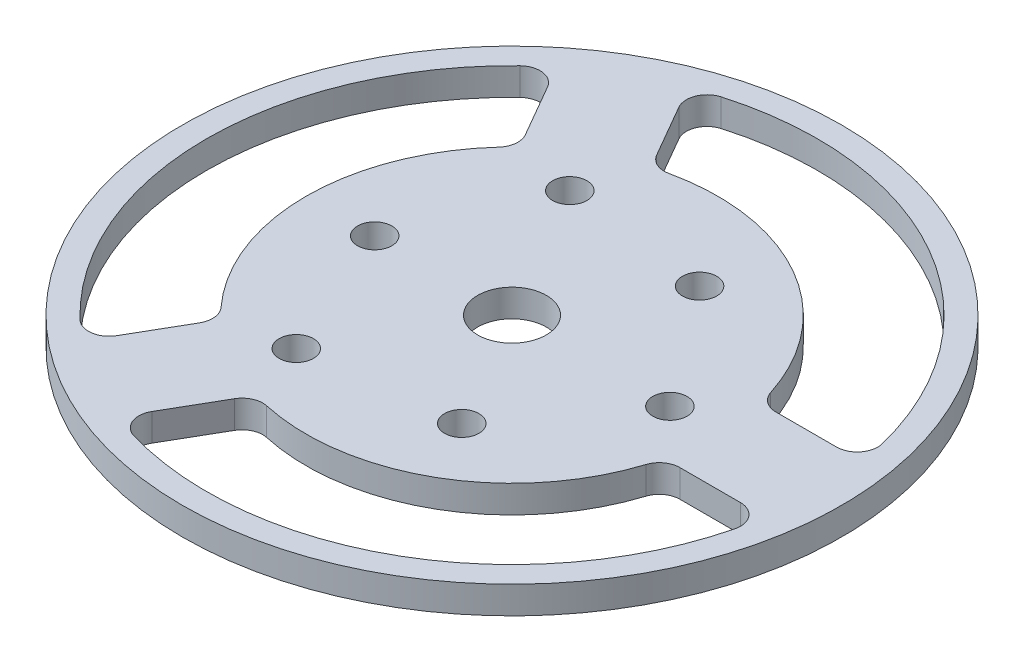
from build123d import *

# Parameters (mm, degrees)
SKETCH1_R           = 24
SKETCH1_R_2         = 2
SKETCH1_R_3         = 1.5
BOSS_EXTRUDE1_DEPTH = 2
CUT_EXTRUDE1_DEPTH  = 2
FILLET1_R           = 1.5
SKETCH3_R           = 1.75
CUT_EXTRUDE2_DEPTH  = 10
SCALE1_SCALE        = 2
SKETCH4_R           = 5
CUT_EXTRUDE3_DEPTH  = 10
SKETCH5_R           = 6.547213639
SKETCH5_R_2         = 2.5
SKETCH5_R_3         = 5.064875416
BOSS_EXTRUDE2_DEPTH = 4


with BuildPart() as part:
    # Sketch1 → Boss-Extrude1 (new body)
    with BuildSketch(Plane(origin=(0, 0, 0), x_dir=(1, 0, 0), z_dir=(0, 1, 0))):
        with Locations(Location((0, 0, 0), (0, 0, 270))):
            Circle(SKETCH1_R)
        with Locations(Location((0, 0, 0), (0, 0, 270))):
            Circle(SKETCH1_R_2, mode=Mode.SUBTRACT)
        with Locations(Location((11.5, 0, 0), (0, 0, 270))):
            Circle(SKETCH1_R_3, mode=Mode.SUBTRACT)
        with Locations(Location((-5.75, -9.959292144, 0), (0, 0, 270))):
            Circle(SKETCH1_R_3, mode=Mode.SUBTRACT)
        with Locations(Location((-5.75, 9.959292144, 0), (0, 0, 270))):
            Circle(SKETCH1_R_3, mode=Mode.SUBTRACT)
    extrude(amount=BOSS_EXTRUDE1_DEPTH)

    # Sketch2 → Cut-Extrude1 (cut)
    with BuildSketch(Plane(origin=(0, 2, 0), x_dir=(1, 0, 0), z_dir=(0, 1, 0))):
        with BuildLine():
            Line((21.972994789, 3.5), (14.585952146, 3.5))
            ThreePointArc((14.585952146, 3.5), (7.5, 12.990381057), (-4.26188716, 14.381805097))
            Line((-4.26188716, 14.381805097), (-7.955408481, 20.779171685))
            ThreePointArc((-7.955408481, 20.779171685), (11.125, 19.269065234), (21.972994789, 3.5))
        make_face()
        with BuildLine():
            Line((21.972994789, -3.5), (14.585952146, -3.5))
            ThreePointArc((14.585952146, -3.5), (7.5, -12.990381057), (-4.26188716, -14.381805097))
            Line((-4.26188716, -14.381805097), (-7.955408481, -20.779171685))
            ThreePointArc((-7.955408481, -20.779171685), (11.125, -19.269065234), (21.972994789, -3.5))
        make_face()
        with BuildLine():
            Line((-14.017586308, -17.279171685), (-10.324064986, -10.881805097))
            ThreePointArc((-10.324064986, -10.881805097), (-15, 0), (-10.324064986, 10.881805097))
            Line((-10.324064986, 10.881805097), (-14.017586308, 17.279171685))
            ThreePointArc((-14.017586308, 17.279171685), (-22.25, 0), (-14.017586308, -17.279171685))
        make_face()
    extrude(amount=-CUT_EXTRUDE1_DEPTH, mode=Mode.SUBTRACT)

    # Fillet1
    fillet1_edges = [part.edges().sort_by_distance(p)[0] for p in [
        (-7.955408481, 1, -20.779171685),
        (21.972994789, 1, -3.5),
        (14.585952146, 1, -3.5),
        (-4.26188716, 1, -14.381805097),
        (-14.017586308, 1, 17.279171685),
        (-14.017586308, 1, -17.279171685),
        (-10.324064986, 1, -10.881805097),
        (-10.324064986, 1, 10.881805097),
        (21.972994789, 1, 3.5),
        (-7.955408481, 1, 20.779171685),
        (-4.26188716, 1, 14.381805097),
        (14.585952146, 1, 3.5),
    ]]
    fillet(fillet1_edges, radius=FILLET1_R)

    # Sketch3 → Cut-Extrude2 (cut)
    with BuildSketch(Plane(origin=(0, 2, 0), x_dir=(1, 0, 0), z_dir=(0, 1, 0))):
        with Locations(Location((5, 8.660254038, 0), (0, 0, 270))):
            Circle(SKETCH3_R)
        with Locations(Location((5, -8.660254038, 0), (0, 0, 270))):
            Circle(SKETCH3_R)
        with Locations(Location((-10, 0, 0), (0, 0, 270))):
            Circle(SKETCH3_R)
    extrude(amount=-CUT_EXTRUDE2_DEPTH, mode=Mode.SUBTRACT)


with BuildPart() as part_1:
    # Scale1: scaled about (0, 1, 0)
    add(part.part.scale(SCALE1_SCALE).moved(Location((0, -1, 0))))

    # Sketch4 → Cut-Extrude3 (cut)
    with BuildSketch(Plane(origin=(0, 3, 0), x_dir=(1, 0, 0), z_dir=(0, 1, 0))):
        with Locations(Location((0, 0, 0), (0, 0, 270))):
            Circle(SKETCH4_R)
    extrude(amount=-CUT_EXTRUDE3_DEPTH, mode=Mode.SUBTRACT)

    # Sketch5 → Boss-Extrude2 (add)
    # profile 1 of 6: a face of its own
    with BuildSketch(Plane(origin=(0, 3, 0), x_dir=(1, 0, 0), z_dir=(0, 1, 0))):
        with Locations((10, 17.320508076)):
            Circle(SKETCH5_R)
        with Locations(Location((10, 17.320508076, 0), (0, 0, 270))):
            Circle(SKETCH5_R_2, mode=Mode.SUBTRACT)
    # profile 2 of 6: a face of its own
    with BuildSketch(Plane(origin=(0, 3, 0), x_dir=(1, 0, 0), z_dir=(0, 1, 0))):
        with Locations((10, -17.320508076)):
            Circle(SKETCH5_R)
        with Locations(Location((10, -17.320508076, 0), (0, 0, 270))):
            Circle(SKETCH5_R_2, mode=Mode.SUBTRACT)
    # profile 3 of 6: a face of its own
    with BuildSketch(Plane(origin=(0, 3, 0), x_dir=(1, 0, 0), z_dir=(0, 1, 0))):
        with Locations((-20, 0)):
            Circle(SKETCH5_R)
        with Locations(Location((-20, 0, 0), (0, 0, 270))):
            Circle(SKETCH5_R_2, mode=Mode.SUBTRACT)
    # profile 4 of 6: a face of its own
    with BuildSketch(Plane(origin=(0, 3, 0), x_dir=(1, 0, 0), z_dir=(0, 1, 0))):
        with Locations((-11.5, 19.918584287)):
            Circle(SKETCH5_R_3)
        with Locations(Location((-11.5, 19.918584287, 0), (0, 0, 270))):
            Circle(SKETCH5_R_2, mode=Mode.SUBTRACT)
    # profile 5 of 6: a face of its own
    with BuildSketch(Plane(origin=(0, 3, 0), x_dir=(1, 0, 0), z_dir=(0, 1, 0))):
        with Locations((23, 0)):
            Circle(SKETCH5_R_3)
        with Locations(Location((23, 0, 0), (0, 0, 270))):
            Circle(SKETCH5_R_2, mode=Mode.SUBTRACT)
    # profile 6 of 6: a face of its own
    with BuildSketch(Plane(origin=(0, 3, 0), x_dir=(1, 0, 0), z_dir=(0, 1, 0))):
        with Locations((-11.5, -19.918584287)):
            Circle(SKETCH5_R_3)
        with Locations(Location((-11.5, -19.918584287, 0), (0, 0, 270))):
            Circle(SKETCH5_R_2, mode=Mode.SUBTRACT)
    extrude(amount=-BOSS_EXTRUDE2_DEPTH)


solid = part_1.part
